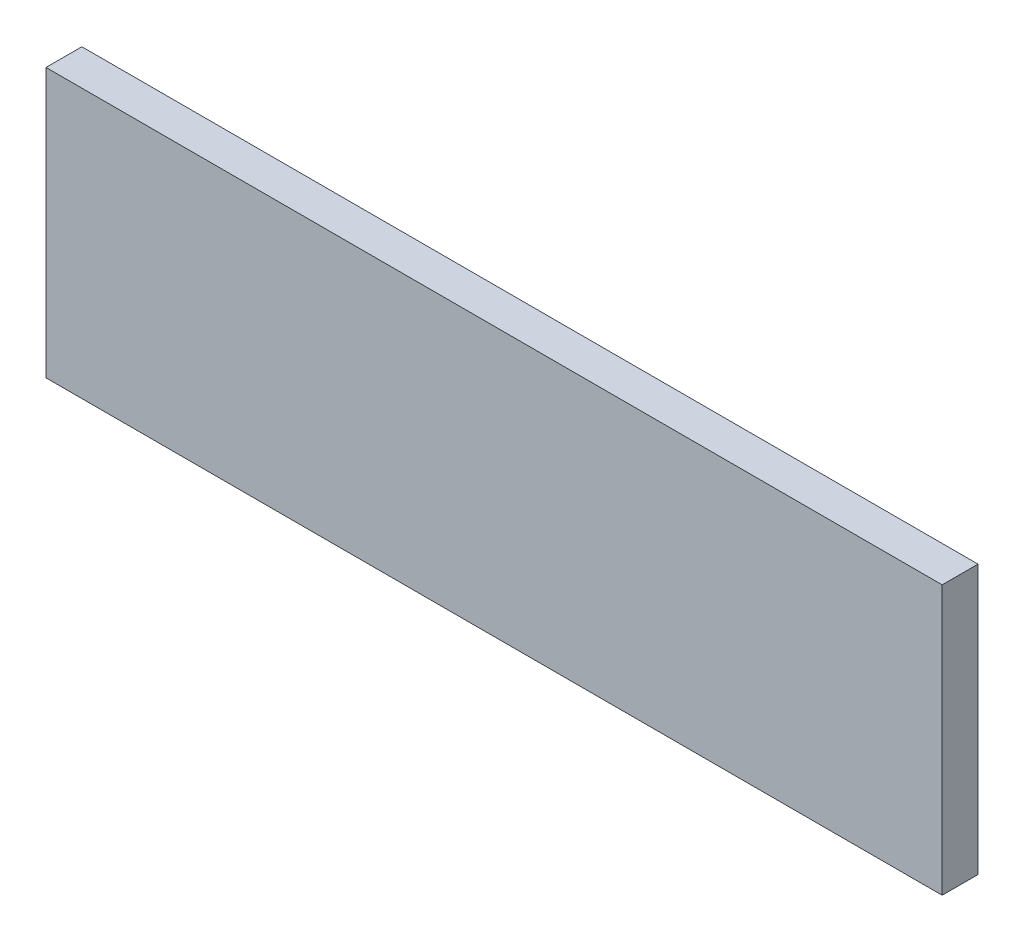
from build123d import *

# Parameters (mm, degrees)
ESQUISSE1_W        = 100
ESQUISSE1_H        = 30
BOSS_EXTRU_1_DEPTH = 4


with BuildPart() as part:
    # Esquisse1 → Boss.-Extru.1 (new body)
    with BuildSketch(Plane.XY):
        with Locations((-14.545454545, -3.566433566)):
            Rectangle(ESQUISSE1_W, ESQUISSE1_H)
    extrude(amount=BOSS_EXTRU_1_DEPTH)


solid = part.part
